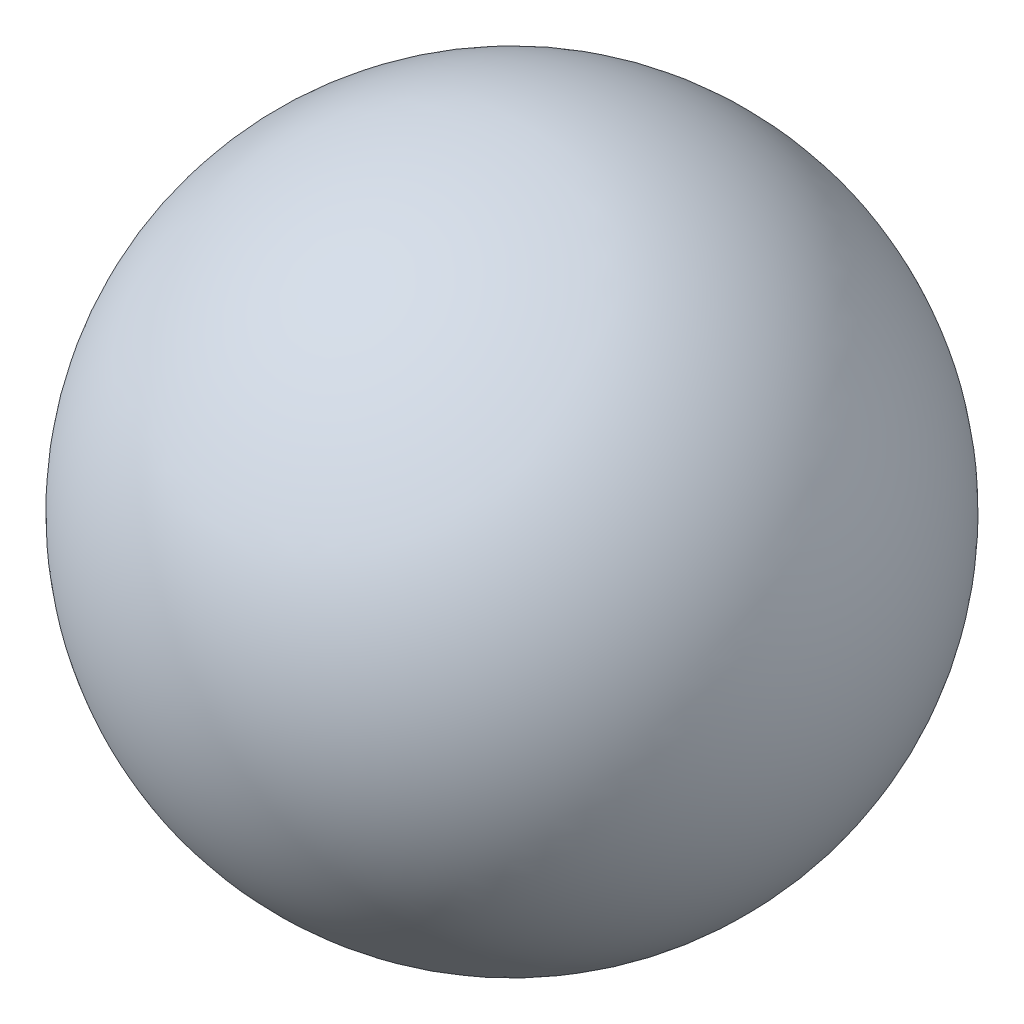
from build123d import *


with BuildPart() as part:
    # Sketch1 → Revolve1 (revolve)
    with BuildSketch(Plane(origin=(0, 0, 0), x_dir=(1, 0, 0), z_dir=(0, 1, 0))):
        with BuildLine():
            Line((0, 25), (0, -25))
            ThreePointArc((0, -25), (-25, 0), (0, 25))
        make_face()
    revolve(axis=Axis((0, 0, -25), (0, 0, 1)))


solid = part.part
